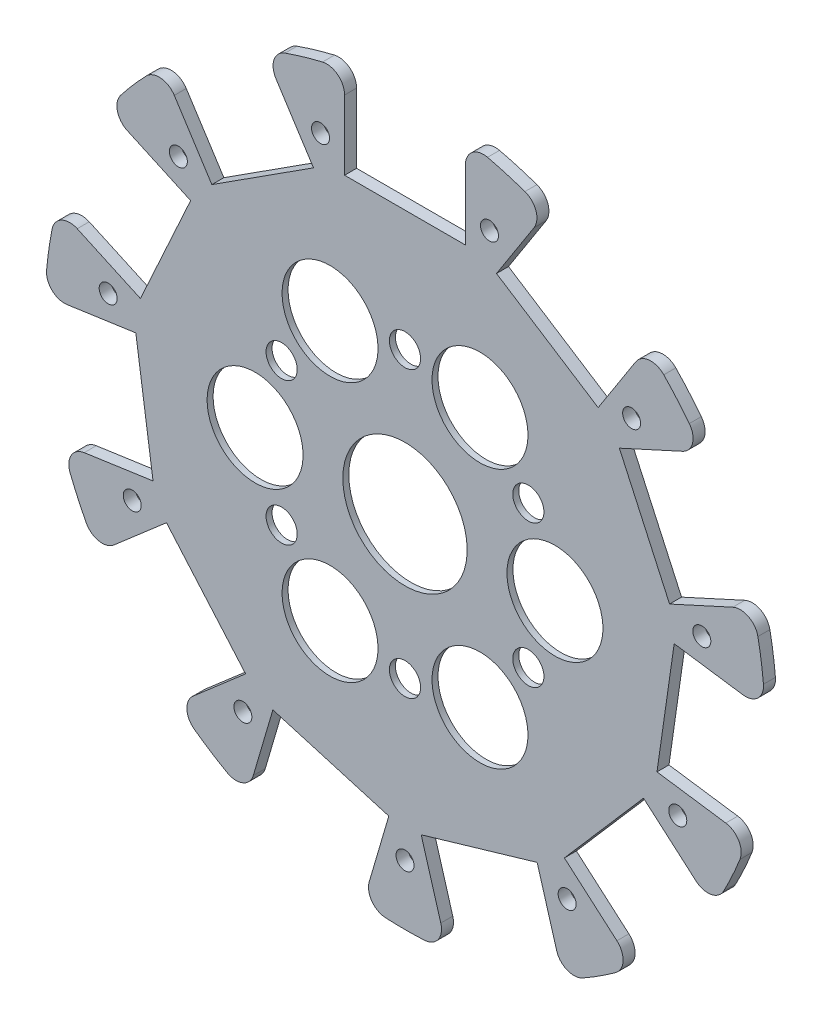
from build123d import *

# Parameters (mm, degrees)
BOSS_EXTRUDE1_DEPTH = 2
SKETCH4_R           = 1.5
CUT_EXTRUDE3_DEPTH  = 2
SKETCH6_R           = 35
CUT_EXTRUDE4_DEPTH  = 1
SKETCH7_R           = 10.365813853
SKETCH7_R_2         = 2.6
SKETCH7_R_3         = 8
CUT_EXTRUDE5_DEPTH  = 1


with BuildPart() as part:
    # Sketch1 → Boss-Extrude1 (new body)
    with BuildSketch(Plane.XY):
        with BuildLine():
            Line((21.520746486, 52.119258472), (15.256667967, 42.372162038))
            Line((15.256667967, 42.372162038), (32.20522538, 31.479985569))
            Line((32.20522538, 31.479985569), (38.4693039, 41.227082003))
            ThreePointArc((38.4693039, 41.227082003), (40.698070229, 42.590620718), (43.150594208, 41.689641633))
            ThreePointArc((43.150594208, 41.689641633), (45.344974461, 39.291644037), (47.406271028, 36.778328771))
            ThreePointArc((47.406271028, 36.778328771), (47.949048893, 34.222545257), (46.282202516, 32.210516346))
            Line((46.282202516, 32.210516346), (35.742846148, 27.397353567))
            Line((35.742846148, 27.397353567), (44.112124759, 9.071189697))
            Line((44.112124759, 9.071189697), (54.651481127, 13.884352476))
            ThreePointArc((54.651481127, 13.884352476), (57.263623361, 13.826472187), (58.839711753, 11.742585779))
            ThreePointArc((58.839711753, 11.742585779), (59.389286513, 8.538890296), (59.764558712, 5.310133889))
            ThreePointArc((59.764558712, 5.310133889), (58.83941162, 2.86662411), (56.349386262, 2.075162869))
            Line((56.349386262, 2.075162869), (44.880923224, 3.724078919))
            Line((44.880923224, 3.724078919), (42.013736207, -16.217644809))
            Line((42.013736207, -16.217644809), (53.482199245, -17.86656086))
            ThreePointArc((53.482199245, -17.86656086), (55.648380681, -19.32748357), (55.847636558, -21.93265809))
            ThreePointArc((55.847636558, -21.93265809), (54.577919721, -24.92490078), (53.148021281, -27.843990983))
            ThreePointArc((53.148021281, -27.843990983), (51.048676897, -29.399429937), (48.526038015, -28.719040157))
            Line((48.526038015, -28.719040157), (39.76962429, -21.131564473))
            Line((39.76962429, -21.131564473), (26.576283265, -36.357491677))
            Line((26.576283265, -36.357491677), (35.33269699, -43.944967362))
            ThreePointArc((35.33269699, -43.944967362), (36.365170327, -46.345099856), (35.124331356, -48.644437984))
            ThreePointArc((35.124331356, -48.644437984), (32.438449047, -50.47521197), (29.657362619, -52.157845455))
            ThreePointArc((29.657362619, -52.157845455), (27.050347952, -52.331372705), (25.296015568, -50.395150852))
            Line((25.296015568, -50.395150852), (22.031750643, -39.278085453))
            Line((22.031750643, -39.278085453), (2.701048165, -44.954091828))
            Line((2.701048165, -44.954091828), (5.96531309, -56.071157227))
            ThreePointArc((5.96531309, -56.071157227), (5.536275339, -58.648474396), (3.249299125, -59.911952524))
            ThreePointArc((3.249299125, -59.911952524), (0, -60), (-3.249299125, -59.911952524))
            ThreePointArc((-3.249299125, -59.911952524), (-5.536275339, -58.648474396), (-5.96531309, -56.071157227))
            Line((-5.96531309, -56.071157227), (-2.701048165, -44.954091828))
            Line((-2.701048165, -44.954091828), (-22.031750643, -39.278085453))
            Line((-22.031750643, -39.278085453), (-25.296015568, -50.395150852))
            ThreePointArc((-25.296015568, -50.395150852), (-27.050347952, -52.331372705), (-29.657362619, -52.157845455))
            ThreePointArc((-29.657362619, -52.157845455), (-32.438449047, -50.47521197), (-35.124331356, -48.644437984))
            ThreePointArc((-35.124331356, -48.644437984), (-36.365170327, -46.345099856), (-35.33269699, -43.944967362))
            Line((-35.33269699, -43.944967362), (-26.576283265, -36.357491677))
            Line((-26.576283265, -36.357491677), (-39.76962429, -21.131564473))
            Line((-39.76962429, -21.131564473), (-48.526038015, -28.719040157))
            ThreePointArc((-48.526038015, -28.719040157), (-51.048676897, -29.399429937), (-53.148021281, -27.843990983))
            ThreePointArc((-53.148021281, -27.843990983), (-54.577919721, -24.92490078), (-55.847636558, -21.93265809))
            ThreePointArc((-55.847636558, -21.93265809), (-55.648380681, -19.32748357), (-53.482199245, -17.86656086))
            Line((-53.482199245, -17.86656086), (-42.013736207, -16.217644809))
            Line((-42.013736207, -16.217644809), (-44.880923224, 3.724078919))
            Line((-44.880923224, 3.724078919), (-56.349386262, 2.075162869))
            ThreePointArc((-56.349386262, 2.075162869), (-58.83941162, 2.86662411), (-59.764558712, 5.310133889))
            ThreePointArc((-59.764558712, 5.310133889), (-59.389286513, 8.538890296), (-58.839711753, 11.742585779))
            ThreePointArc((-58.839711753, 11.742585779), (-57.263623361, 13.826472187), (-54.651481127, 13.884352476))
            Line((-54.651481127, 13.884352476), (-44.112124759, 9.071189697))
            Line((-44.112124759, 9.071189697), (-35.742846148, 27.397353567))
            Line((-35.742846148, 27.397353567), (-46.282202516, 32.210516346))
            ThreePointArc((-46.282202516, 32.210516346), (-47.949048893, 34.222545257), (-47.406271028, 36.778328771))
            ThreePointArc((-47.406271028, 36.778328771), (-45.344974461, 39.291644037), (-43.150594208, 41.689641633))
            ThreePointArc((-43.150594208, 41.689641633), (-40.698070229, 42.590620718), (-38.4693039, 41.227082003))
            Line((-38.4693039, 41.227082003), (-32.20522538, 31.479985569))
            Line((-32.20522538, 31.479985569), (-15.256667967, 42.372162038))
            Line((-15.256667967, 42.372162038), (-21.520746486, 52.119258472))
            ThreePointArc((-21.520746486, 52.119258472), (-21.835201934, 54.713050089), (-19.99682725, 56.569664131))
            ThreePointArc((-19.99682725, 56.569664131), (-16.90395341, 57.569578417), (-13.76146789, 58.400530832))
            ThreePointArc((-13.76146789, 58.400530832), (-11.211167359, 57.832548102), (-10.073394495, 55.480504291))
            Line((-10.073394495, 55.480504291), (-10.073394495, 43.894108449))
            Line((-10.073394495, 43.894108449), (10.073394495, 43.894108449))
            Line((10.073394495, 43.894108449), (10.073394495, 55.480504291))
            ThreePointArc((10.073394495, 55.480504291), (11.211167359, 57.832548102), (13.76146789, 58.400530832))
            ThreePointArc((13.76146789, 58.400530832), (16.90395341, 57.569578417), (19.99682725, 56.569664131))
            ThreePointArc((19.99682725, 56.569664131), (21.835201934, 54.713050089), (21.520746486, 52.119258472))
        make_face()
    extrude(amount=BOSS_EXTRUDE1_DEPTH)

    # Sketch4 → Cut-Extrude3 (cut)
    with BuildSketch(Plane.XY.offset(2)):
        with Locations((-14.086627842, 47.974648681)):
            Circle(SKETCH4_R)
        with Locations((14.086627842, 47.974648681)):
            Circle(SKETCH4_R)
        with Locations((37.787478718, 32.743036697)):
            Circle(SKETCH4_R)
        with Locations((49.491072094, 7.115741914)):
            Circle(SKETCH4_R)
        with Locations((45.481599768, -20.77075065)):
            Circle(SKETCH4_R)
        with Locations((27.032040873, -42.062676642)):
            Circle(SKETCH4_R)
        with Locations((0, -50)):
            Circle(SKETCH4_R)
        with Locations((-27.032040873, -42.062676642)):
            Circle(SKETCH4_R)
        with Locations((-45.481599768, -20.77075065)):
            Circle(SKETCH4_R)
        with Locations((-49.491072094, 7.115741914)):
            Circle(SKETCH4_R)
        with Locations((-37.787478718, 32.743036697)):
            Circle(SKETCH4_R)
    extrude(amount=-CUT_EXTRUDE3_DEPTH, mode=Mode.SUBTRACT)

    # Sketch6 → Cut-Extrude4 (cut)
    with BuildSketch(Plane(origin=(0, 0, 0), x_dir=(-1, 0, 0), z_dir=(0, 0, -1))):
        Circle(SKETCH6_R)
    extrude(amount=-CUT_EXTRUDE4_DEPTH, mode=Mode.SUBTRACT)

    # Sketch7 → Cut-Extrude5 (cut)
    with BuildSketch(Plane(origin=(0, 0, 1), x_dir=(-1, 0, 0), z_dir=(0, 0, -1))):
        Circle(SKETCH7_R)
        with Locations((0, 23.75)):
            Circle(SKETCH7_R_2)
        with Locations((-12.5, 21.650635095)):
            Circle(SKETCH7_R_3)
        with Locations((20.56810334, 11.875)):
            Circle(SKETCH7_R_2)
        with Locations((12.5, 21.650635095)):
            Circle(SKETCH7_R_3)
        with Locations((20.56810334, -11.875)):
            Circle(SKETCH7_R_2)
        with Locations((25, 0)):
            Circle(SKETCH7_R_3)
        with Locations((0, -23.75)):
            Circle(SKETCH7_R_2)
        with Locations((12.5, -21.650635095)):
            Circle(SKETCH7_R_3)
        with Locations((-20.56810334, -11.875)):
            Circle(SKETCH7_R_2)
        with Locations((-12.5, -21.650635095)):
            Circle(SKETCH7_R_3)
        with Locations((-20.56810334, 11.875)):
            Circle(SKETCH7_R_2)
        with Locations((-25, 0)):
            Circle(SKETCH7_R_3)
    extrude(amount=-CUT_EXTRUDE5_DEPTH, mode=Mode.SUBTRACT)


solid = part.part
